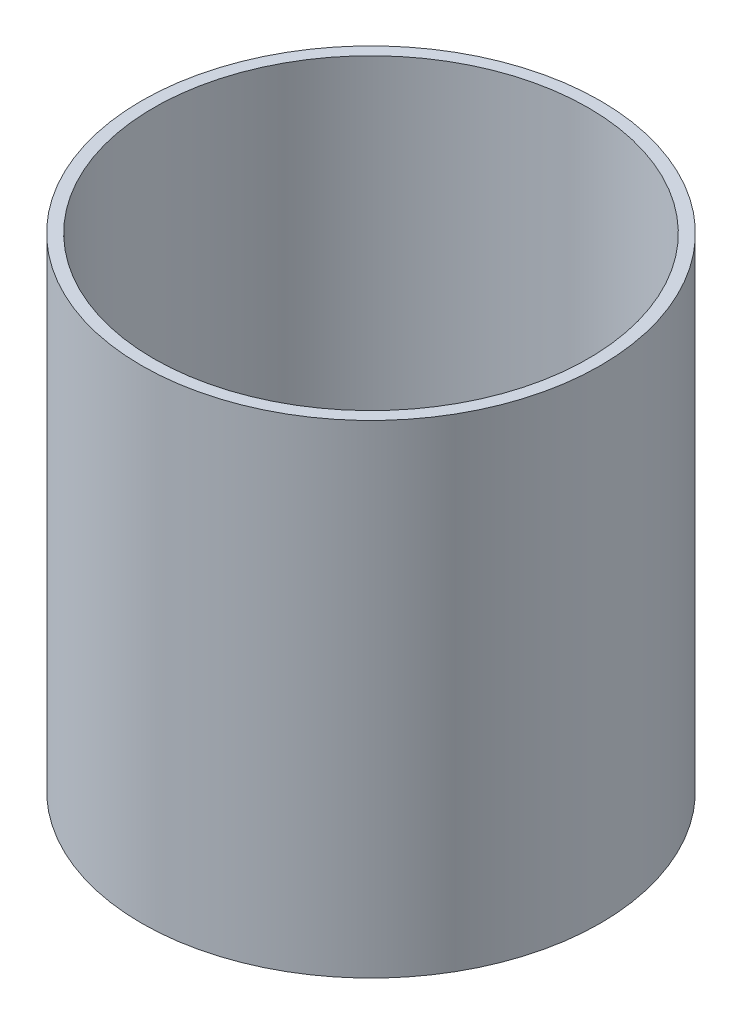
from build123d import *

# Parameters (mm, degrees)
SKETCH2_R           = 38
SKETCH2_R_2         = 36
BOSS_EXTRUDE1_DEPTH = 80


with BuildPart() as part:
    # Sketch2 → Boss-Extrude1 (new body)
    with BuildSketch(Plane(origin=(0, 0, 0), x_dir=(1, 0, 0), z_dir=(0, 1, 0))):
        with Locations(Location((0, 0, 0), (0, 0, 270))):
            Circle(SKETCH2_R)
        with Locations(Location((0, 0, 0), (0, 0, 270))):
            Circle(SKETCH2_R_2, mode=Mode.SUBTRACT)
    extrude(amount=BOSS_EXTRUDE1_DEPTH)


solid = part.part
